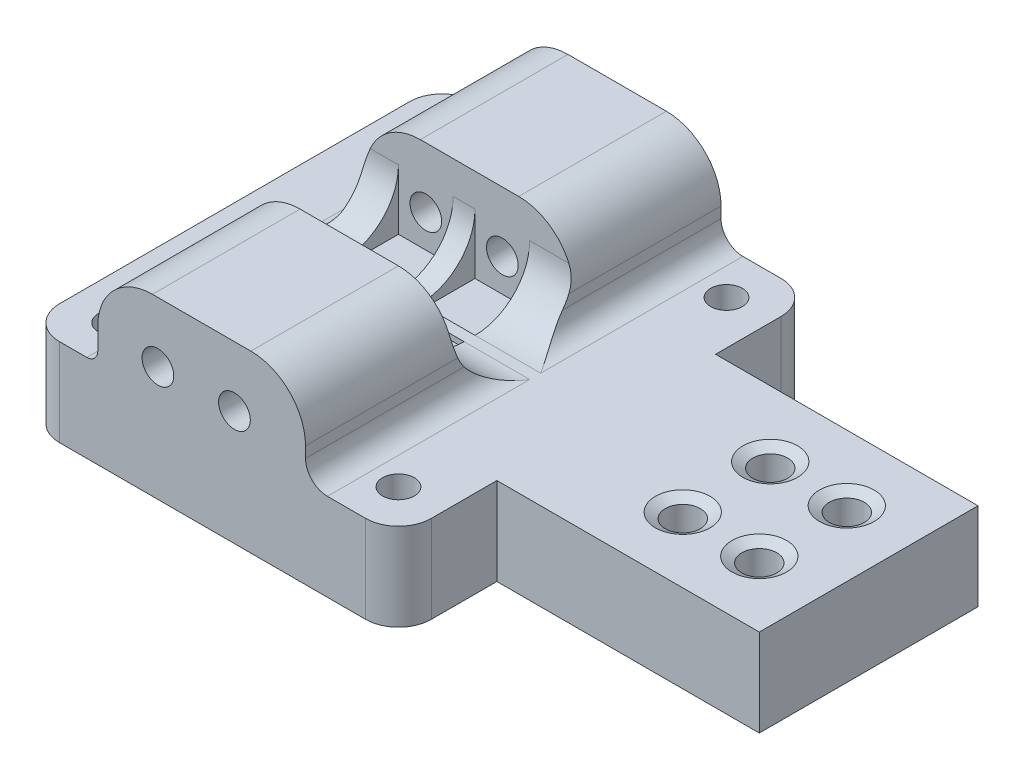
from build123d import *

# Parameters (mm, degrees)
SKETCH1_W                 = 300
SKETCH1_H                 = 20
BOSS_EXTRUDE1_DEPTH       = 8
SKETCH2_W                 = 34
SKETCH2_H                 = 8
BOSS_EXTRUDE2_DEPTH       = 9
SKETCH3_W                 = 34
SKETCH3_H                 = 8
BOSS_EXTRUDE3_DEPTH       = 9
SKETCH4_R                 = 1.45
CUT_EXTRUDE1_DEPTH        = 302.504560496
SKETCH5_W                 = 25
SKETCH5_H                 = 8
BOSS_EXTRUDE4_DEPTH       = 17
SKETCH6_W                 = 25
SKETCH6_H                 = 8
BOSS_EXTRUDE5_DEPTH       = 17
SKETCH12_W                = 8
SKETCH12_H                = 8
BOSS_EXTRUDE7_DEPTH       = 17
BOSS_EXTRUDE8_DEPTH       = 12
SKETCH15_R                = 1.6
CUT_EXTRUDE7_DEPTH        = 20
SKETCH16_W                = 20
SKETCH16_H                = 13
BOSS_EXTRUDE9_DEPTH       = 12
SKETCH17_R                = 1.6
CUT_EXTRUDE8_DEPTH        = 20
SKETCH22_W                = 10
SKETCH22_H                = 38
CUT_EXTRUDE11_DEPTH       = 306.0983448
SKETCH23_W                = 8
SKETCH23_H                = 18
CUT_EXTRUDE12_DEPTH       = 4
BOSS_EXTRUDE12_DEPTH      = 10
BOSS_EXTRUDE13_DEPTH      = 8
SKETCH26_W                = 8
SKETCH26_H                = 48
BOSS_EXTRUDE14_DEPTH      = 14
SKETCH27_W                = 8
SKETCH27_H                = 16
BOSS_EXTRUDE15_DEPTH      = 14
SKETCH28_W                = 8
SKETCH28_H                = 40
CUT_EXTRUDE13_DEPTH       = 14
SKETCH30_W                = 16
SKETCH30_H                = 14
BOSS_EXTRUDE16_DEPTH      = 9
SKETCH31_W                = 17
SKETCH31_H                = 8
CUT_EXTRUDE14_DEPTH       = 5
SKETCH32_W                = 16
SKETCH32_H                = 9
CUT_EXTRUDE15_DEPTH       = 9
CUT_EXTRUDE16_DEPTH       = 10
SKETCH34_W                = 7
SKETCH34_H                = 5
CUT_EXTRUDE17_DEPTH       = 5
SKETCH35_W                = 7
SKETCH35_H                = 5
BOSS_EXTRUDE17_DEPTH      = 5
SKETCH36_R                = 1.7
CUT_EXTRUDE18_DEPTH       = 307.014705529
SKETCH37_W                = 70
SKETCH37_H                = 8
BOSS_EXTRUDE18_DEPTH      = 5
SKETCH39_W                = 66
SKETCH39_H                = 6
CUT_EXTRUDE19_DEPTH       = 306.14258962
SKETCH46_W                = 20
SKETCH46_H                = 12
SKETCH46_W_2              = 19.974984355
BOSS_EXTRUDE23_DEPTH      = 10
BOSS_EXTRUDE24_DEPTH      = 5
BOSS_EXTRUDE24_DEPTH_BACK = 5
SKETCH47_W                = 28
SKETCH47_H                = 12
SKETCH47_W_2              = 28.025015645
SKETCH48_R                = 1.5
CUT_EXTRUDE22_DEPTH       = 15
SKETCH49_R                = 1.45
CUT_EXTRUDE23_DEPTH       = 309.139578763
SKETCH50_W                = 96.54170444
SKETCH50_H                = 99.159492098
CUT_EXTRUDE24_DEPTH       = 245
SKETCH51_R                = 1.6
CUT_EXTRUDE25_DEPTH       = 66.337584896
SKETCH52_W                = 19
SKETCH52_H                = 13.5
BOSS_EXTRUDE25_DEPTH      = 8
FILLET1_R                 = 5
SKETCH53_R                = 1.45
CUT_EXTRUDE26_DEPTH       = 72.161787499
FILLET2_R                 = 5
FILLET3_R                 = 3
SKETCH54_W                = 5
SKETCH54_H                = 5
CUT_EXTRUDE27_DEPTH       = 8.5
FILLET4_R                 = 1
FILLET5_R                 = 2


with BuildPart() as part:
    # Sketch1 → Boss-Extrude1 (new body)
    with BuildSketch(Plane(origin=(0, 0, 0), x_dir=(1, 0, 0), z_dir=(0, 1, 0))):
        with Locations((150, -10)):
            Rectangle(SKETCH1_W, SKETCH1_H)
    extrude(amount=BOSS_EXTRUDE1_DEPTH)

    # Sketch2 → Boss-Extrude2 (add)
    with BuildSketch(Plane.XY.offset(20)):
        with Locations((17, 4)):
            Rectangle(SKETCH2_W, SKETCH2_H)
        with Locations((283, 4)):
            Rectangle(SKETCH2_W, SKETCH2_H)
    extrude(amount=BOSS_EXTRUDE2_DEPTH)

    # Sketch3 → Boss-Extrude3 (add)
    with BuildSketch(Plane(origin=(0, 0, 0), x_dir=(-1, 0, 0), z_dir=(0, 0, -1))):
        with Locations((-17, 4)):
            Rectangle(SKETCH3_W, SKETCH3_H)
        with Locations((-283, 4)):
            Rectangle(SKETCH3_W, SKETCH3_H)
    extrude(amount=BOSS_EXTRUDE3_DEPTH)

    # Sketch4 → Cut-Extrude1 (cut, through all)
    with BuildSketch(Plane(origin=(0, 8, 0), x_dir=(1, 0, 0), z_dir=(0, 1, 0))):
        with Locations(Location((4, 5, 0), (0, 0, 270))):
            Circle(SKETCH4_R)
        with Locations(Location((30, 5, 0), (0, 0, 270))):
            Circle(SKETCH4_R)
        with Locations(Location((30, -25, 0), (0, 0, 270))):
            Circle(SKETCH4_R)
        with Locations(Location((4, -25, 0), (0, 0, 270))):
            Circle(SKETCH4_R)
        with Locations(Location((296, -25, 0), (0, 0, 270))):
            Circle(SKETCH4_R)
        with Locations(Location((296, 5, 0), (0, 0, 270))):
            Circle(SKETCH4_R)
        with Locations(Location((270, -25, 0), (0, 0, 270))):
            Circle(SKETCH4_R)
        with Locations(Location((270, 5, 0), (0, 0, 270))):
            Circle(SKETCH4_R)
    extrude(amount=-CUT_EXTRUDE1_DEPTH, mode=Mode.SUBTRACT)

    # Sketch5 → Boss-Extrude4 (add)
    with BuildSketch(Plane.XY.offset(20)):
        with Locations((253.5, 4)):
            Rectangle(SKETCH5_W, SKETCH5_H)
    extrude(amount=BOSS_EXTRUDE4_DEPTH)

    # Sketch6 → Boss-Extrude5 (add)
    with BuildSketch(Plane(origin=(0, 0, 0), x_dir=(-1, 0, 0), z_dir=(0, 0, -1))):
        with Locations((-253.5, 4)):
            Rectangle(SKETCH6_W, SKETCH6_H)
    extrude(amount=BOSS_EXTRUDE5_DEPTH)

    # Sketch12 → Boss-Extrude7 (add)
    with BuildSketch(Plane.XY.offset(37)):
        with Locations((245, 4)):
            Rectangle(SKETCH12_W, SKETCH12_H)
    extrude(amount=BOSS_EXTRUDE7_DEPTH)

    # Sketch14 → Boss-Extrude8 (add)
    with BuildSketch(Plane.XY.offset(29)):
        Polygon((294.974984355, 8), (275, 8), (275, -4), (294.974984355, -5), align=None)
    extrude(amount=BOSS_EXTRUDE8_DEPTH)

    # Sketch15 → Cut-Extrude7 (cut)
    with BuildSketch(Plane(origin=(294.974984355, 0, 0), x_dir=(0, 0, -1), z_dir=(1, 0, 0))):
        with Locations((-35, 0)):
            Circle(SKETCH15_R)
    extrude(amount=-CUT_EXTRUDE7_DEPTH, mode=Mode.SUBTRACT)

    # Sketch16 → Boss-Extrude9 (add)
    with BuildSketch(Plane(origin=(0, 0, -9), x_dir=(-1, 0, 0), z_dir=(0, 0, -1))):
        with Locations((-285, 1.5)):
            Rectangle(SKETCH16_W, SKETCH16_H)
    extrude(amount=BOSS_EXTRUDE9_DEPTH)

    # Sketch17 → Cut-Extrude8 (cut)
    with BuildSketch(Plane(origin=(295, 0, 0), x_dir=(0, 0, -1), z_dir=(1, 0, 0))):
        with Locations((15, 0)):
            Circle(SKETCH17_R)
    extrude(amount=-CUT_EXTRUDE8_DEPTH, mode=Mode.SUBTRACT)

    # Sketch22 → Cut-Extrude11 (cut, through all)
    with BuildSketch(Plane(origin=(0, 8, 0), x_dir=(1, 0, 0), z_dir=(0, 1, 0))):
        with Locations((254, -10)):
            Rectangle(SKETCH22_W, SKETCH22_H)
    extrude(amount=-CUT_EXTRUDE11_DEPTH, mode=Mode.SUBTRACT)

    # Sketch23 → Cut-Extrude12 (cut)
    with BuildSketch(Plane(origin=(0, 0, 0), x_dir=(-1, 0, 0), z_dir=(0, -1, 0))):
        with Locations((-263, -10)):
            Rectangle(SKETCH23_W, SKETCH23_H)
    extrude(amount=-CUT_EXTRUDE12_DEPTH, mode=Mode.SUBTRACT)

    # Sketch24 → Boss-Extrude12 (add)
    with BuildSketch(Plane.ZY.offset(-259)):
        Polygon((-9, 0), (-9, 8), (-1, 8), align=None)
        Polygon((29, 0), (29, 8), (21, 8), align=None)
    extrude(amount=BOSS_EXTRUDE12_DEPTH)

    # Sketch25 → Boss-Extrude13 (add)
    with BuildSketch(Plane.ZY.offset(-267)):
        Polygon((19, 0), (19, 4), (15, 4), align=None)
        Polygon((1, 4), (5, 4), (1, 0), align=None)
    extrude(amount=BOSS_EXTRUDE13_DEPTH)

    # Sketch26 → Boss-Extrude14 (add)
    with BuildSketch(Plane(origin=(0, 8, 0), x_dir=(1, 0, 0), z_dir=(0, 1, 0))):
        with Locations((245, -30)):
            Rectangle(SKETCH26_W, SKETCH26_H)
    extrude(amount=BOSS_EXTRUDE14_DEPTH)

    # Sketch27 → Boss-Extrude15 (add)
    with BuildSketch(Plane(origin=(0, 8, 0), x_dir=(1, 0, 0), z_dir=(0, 1, 0))):
        with Locations((253, -29)):
            Rectangle(SKETCH27_W, SKETCH27_H)
    extrude(amount=BOSS_EXTRUDE15_DEPTH)

    # Sketch28 → Cut-Extrude13 (cut)
    with BuildSketch(Plane.XZ):
        with Locations((245, 34)):
            Rectangle(SKETCH28_W, SKETCH28_H)
    extrude(amount=-CUT_EXTRUDE13_DEPTH, mode=Mode.SUBTRACT)

    # Sketch30 → Boss-Extrude16 (add)
    with BuildSketch(Plane(origin=(257, 0, 0), x_dir=(0, 0, -1), z_dir=(1, 0, 0))):
        with Locations((-29, 15)):
            Rectangle(SKETCH30_W, SKETCH30_H)
    extrude(amount=BOSS_EXTRUDE16_DEPTH)

    # Sketch31 → Cut-Extrude14 (cut)
    with BuildSketch(Plane(origin=(0, 0, 0), x_dir=(-1, 0, 0), z_dir=(0, -1, 0))):
        with Locations((-257.5, -33)):
            Rectangle(SKETCH31_W, SKETCH31_H)
    extrude(amount=-CUT_EXTRUDE14_DEPTH, mode=Mode.SUBTRACT)

    # Sketch32 → Cut-Extrude15 (cut)
    with BuildSketch(Plane(origin=(266, 0, 0), x_dir=(0, 0, -1), z_dir=(1, 0, 0))):
        with Locations((-29, 17.5)):
            Rectangle(SKETCH32_W, SKETCH32_H)
    extrude(amount=-CUT_EXTRUDE15_DEPTH, mode=Mode.SUBTRACT)

    # Sketch33 → Cut-Extrude16 (cut)
    with BuildSketch(Plane.ZY.offset(-249)):
        Polygon((29, 5), (24, 5), (29, 0), align=None)
    extrude(amount=-CUT_EXTRUDE16_DEPTH, mode=Mode.SUBTRACT)

    # Sketch34 → Cut-Extrude17 (cut)
    with BuildSketch(Plane.XY.offset(29)):
        with Locations((262.5, 2.5)):
            Rectangle(SKETCH34_W, SKETCH34_H)
    extrude(amount=-CUT_EXTRUDE17_DEPTH, mode=Mode.SUBTRACT)

    # Sketch35 → Boss-Extrude17 (add)
    with BuildSketch(Plane(origin=(0, 0, 21), x_dir=(-1, 0, 0), z_dir=(0, 0, -1))):
        with Locations((-262.5, 10.5)):
            Rectangle(SKETCH35_W, SKETCH35_H)
    extrude(amount=BOSS_EXTRUDE17_DEPTH)

    # Sketch36 → Cut-Extrude18 (cut, through all)
    with BuildSketch(Plane(origin=(0, 22, 0), x_dir=(1, 0, 0), z_dir=(0, 1, 0))):
        with Locations(Location((245, -50, 0), (0, 0, 270))):
            Circle(SKETCH36_R)
        with Locations(Location((245, -18, 0), (0, 0, 270))):
            Circle(SKETCH36_R)
    extrude(amount=-CUT_EXTRUDE18_DEPTH, mode=Mode.SUBTRACT)

    # Sketch37 → Boss-Extrude18 (add)
    with BuildSketch(Plane(origin=(0, 8, 0), x_dir=(1, 0, 0), z_dir=(0, 1, 0))):
        with Locations((206, -10)):
            Rectangle(SKETCH37_W, SKETCH37_H)
    extrude(amount=BOSS_EXTRUDE18_DEPTH)

    # Sketch39 → Cut-Extrude19 (cut, through all)
    with BuildSketch(Plane(origin=(0, 8, 0), x_dir=(1, 0, 0), z_dir=(0, 1, 0))):
        with Locations((208, -17)):
            Rectangle(SKETCH39_W, SKETCH39_H)
    extrude(amount=-CUT_EXTRUDE19_DEPTH, mode=Mode.SUBTRACT)

    # Sketch46 → Boss-Extrude23 (add)
    with BuildSketch(Plane(origin=(0, 8, 0), x_dir=(1, 0, 0), z_dir=(0, 1, 0))):
        with Locations((285, 15)):
            Rectangle(SKETCH46_W, SKETCH46_H)
        with Locations((284.987492178, -35)):
            Rectangle(SKETCH46_W_2, SKETCH46_H)
    extrude(amount=BOSS_EXTRUDE23_DEPTH)

    # Sketch47 → Boss-Extrude24 (add, two sides: drawn at the far end of the back side and taken through both)
    with BuildSketch(Plane(origin=(0, 18, 0), x_dir=(1, 0, 0), z_dir=(0, 1, 0)).offset(-BOSS_EXTRUDE24_DEPTH_BACK)):
        with Locations((289, 15)):
            Rectangle(SKETCH47_W, SKETCH47_H)
        with Locations((288.987492178, -35)):
            Rectangle(SKETCH47_W_2, SKETCH47_H)
    extrude(amount=BOSS_EXTRUDE24_DEPTH + BOSS_EXTRUDE24_DEPTH_BACK)

    # Sketch48 → Cut-Extrude22 (cut)
    with BuildSketch(Plane(origin=(303, 0, 0), x_dir=(0, 0, -1), z_dir=(1, 0, 0))):
        with Locations((16, 18)):
            Circle(SKETCH48_R)
        with Locations((-36, 18)):
            Circle(SKETCH48_R)
    extrude(amount=-CUT_EXTRUDE22_DEPTH, mode=Mode.SUBTRACT)

    # Sketch49 → Cut-Extrude23 (cut, through all)
    with BuildSketch(Plane(origin=(0, 8, 0), x_dir=(1, 0, 0), z_dir=(0, 1, 0))):
        with Locations(Location((78, -8, 0), (0, 0, 270))):
            Circle(SKETCH49_R)
        with Locations(Location((78, -12, 0), (0, 0, 270))):
            Circle(SKETCH49_R)
    extrude(amount=-CUT_EXTRUDE23_DEPTH, mode=Mode.SUBTRACT)

    # Sketch50 → Cut-Extrude24 (cut)
    with BuildSketch(Plane(origin=(303, 0, 0), x_dir=(0, 0, -1), z_dir=(1, 0, 0))):
        with Locations((-19.562356109, -1.790710069)):
            Rectangle(SKETCH50_W, SKETCH50_H)
    extrude(amount=-CUT_EXTRUDE24_DEPTH, mode=Mode.SUBTRACT)

    # Sketch51 → Cut-Extrude25 (cut, through all)
    with BuildSketch(Plane(origin=(0, 8, 0), x_dir=(1, 0, 0), z_dir=(0, 1, 0))):
        with Locations(Location((52, -14, 0), (0, 0, 270))):
            Circle(SKETCH51_R)
        with Locations(Location((45, -14, 0), (0, 0, 270))):
            Circle(SKETCH51_R)
        with Locations(Location((45, -6, 0), (0, 0, 270))):
            Circle(SKETCH51_R)
        with Locations(Location((52, -6, 0), (0, 0, 270))):
            Circle(SKETCH51_R)
    extrude(amount=-CUT_EXTRUDE25_DEPTH, mode=Mode.SUBTRACT)

    # Sketch52 → Boss-Extrude25 (add)
    with BuildSketch(Plane(origin=(0, 8, 0), x_dir=(1, 0, 0), z_dir=(0, 1, 0))):
        with Locations((16, 2.25)):
            Rectangle(SKETCH52_W, SKETCH52_H)
        with Locations((16, -22.25)):
            Rectangle(SKETCH52_W, SKETCH52_H)
    extrude(amount=BOSS_EXTRUDE25_DEPTH)

    # Fillet1
    fillet1_edges = [part.edges().sort_by_distance(p)[0] for p in [
        (16, 8, 4.5),
        (16, 8, 15.5),
    ]]
    fillet(fillet1_edges, radius=FILLET1_R)

    # Sketch53 → Cut-Extrude26 (cut, through all)
    with BuildSketch(Plane(origin=(0, 0, -9), x_dir=(-1, 0, 0), z_dir=(0, 0, -1))):
        with Locations((-19, 10.5)):
            Circle(SKETCH53_R)
        with Locations((-12, 10.5)):
            Circle(SKETCH53_R)
    extrude(amount=-CUT_EXTRUDE26_DEPTH, mode=Mode.SUBTRACT)

    # Fillet2
    fillet2_edges = [part.edges().sort_by_distance(p)[0] for p in [
        (25.5, 16, 22.25),
        (6.5, 16, 22.25),
        (6.5, 16, -2.25),
        (25.5, 16, -2.25),
    ]]
    fillet(fillet2_edges, radius=FILLET2_R)

    # Fillet3
    fillet3_edges = [part.edges().sort_by_distance(p)[0] for p in [
        (0, 4, 29),
        (34, 4, 29),
        (0, 4, -9),
        (34, 4, -9),
    ]]
    fillet(fillet3_edges, radius=FILLET3_R)

    # Sketch54 → Cut-Extrude27 (cut)
    with BuildSketch(Plane(origin=(0, 16, 0), x_dir=(1, 0, 0), z_dir=(0, 1, 0))):
        with Locations((19, -7)):
            Rectangle(SKETCH54_W, SKETCH54_H)
        with Locations((12, -7)):
            Rectangle(SKETCH54_W, SKETCH54_H)
        with Locations((19, -13)):
            Rectangle(SKETCH54_W, SKETCH54_H)
        with Locations((12, -13)):
            Rectangle(SKETCH54_W, SKETCH54_H)
    extrude(amount=-CUT_EXTRUDE27_DEPTH, mode=Mode.SUBTRACT)

    # Fillet4
    fillet4_edges = [part.edges().sort_by_distance(p)[0] for p in [
        (6.5, 8, 0.25),
        (6.5, 8, 19.75),
    ]]
    fillet(fillet4_edges, radius=FILLET4_R)

    # Fillet5
    fillet5_edges = [part.edges().sort_by_distance(p)[0] for p in [
        (25.5, 8, 0.25),
        (25.5, 8, 19.75),
    ]]
    fillet(fillet5_edges, radius=FILLET5_R)

    # Cut-Extrude28 cone 1 section (through the dimple's axis) → Cut-Extrude28 (revolve, cut)
    with BuildSketch(Plane(origin=(45, 8, 6), x_dir=(0, 0, 1), z_dir=(1, 0, 0))):
        Polygon((0, 0), (2.5, 0), (0, 1.443375673), align=None)
    revolve(axis=Axis((45, 8, 6), (0, -1, 0)), mode=Mode.SUBTRACT)

    # Cut-Extrude28 cone 2 section (through the dimple's axis) → Cut-Extrude28 cone 2 (revolve, cut)
    with BuildSketch(Plane(origin=(52, 8, 6), x_dir=(0, 0, 1), z_dir=(1, 0, 0))):
        Polygon((0, 0), (2.5, 0), (0, 1.443375673), align=None)
    revolve(axis=Axis((52, 8, 6), (0, -1, 0)), mode=Mode.SUBTRACT)

    # Cut-Extrude28 cone 3 section (through the dimple's axis) → Cut-Extrude28 cone 3 (revolve, cut)
    with BuildSketch(Plane(origin=(52, 8, 14), x_dir=(0, 0, 1), z_dir=(1, 0, 0))):
        Polygon((0, 0), (2.5, 0), (0, 1.443375673), align=None)
    revolve(axis=Axis((52, 8, 14), (0, -1, 0)), mode=Mode.SUBTRACT)

    # Cut-Extrude28 cone 4 section (through the dimple's axis) → Cut-Extrude28 cone 4 (revolve, cut)
    with BuildSketch(Plane(origin=(45, 8, 14), x_dir=(0, 0, 1), z_dir=(1, 0, 0))):
        Polygon((0, 0), (2.5, 0), (0, 1.443375673), align=None)
    revolve(axis=Axis((45, 8, 14), (0, -1, 0)), mode=Mode.SUBTRACT)


solid = part.part
